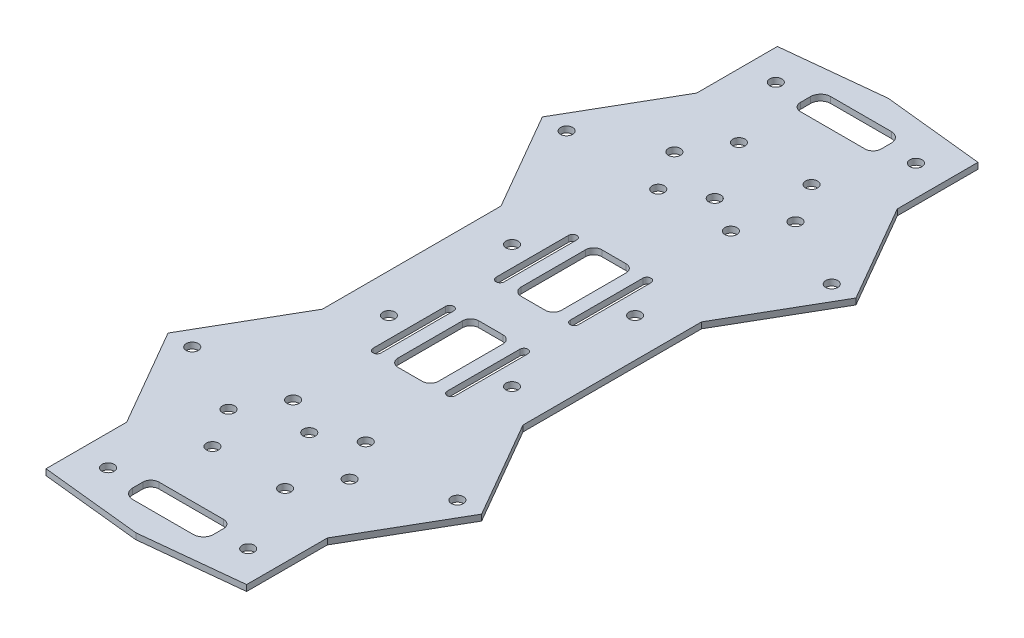
from build123d import *

# Parameters (mm, degrees)
SKETCH1_R           = 1.5
BOSS_EXTRUDE1_DEPTH = 1.5
CUT_EXTRUDE1_DEPTH  = 1.5


with BuildPart() as part:
    # Sketch1 → Boss-Extrude1 (new body)
    with BuildSketch(Plane(origin=(0, 0, 0), x_dir=(1, 0, 0), z_dir=(0, 1, 0))):
        Polygon((0, 93.25), (-24.863047384, 90.636788418), (-24.863047384, 70.636788418), (-38.863047384, 46.388077112), (-24.863047384, 22.139365806), (-24.863047384, -22.139365806), (-38.863047384, -46.388077112), (-24.863047384, -70.636788418), (-24.863047384, -90.636788418), (0, -93.25), (24.863047384, -90.636788418), (24.863047384, -70.636788418), (38.863047384, -46.388077112), (24.863047384, -22.139365806), (24.863047384, 22.139365806), (38.863047384, 46.388077112), (24.863047384, 70.636788418), (24.863047384, 90.636788418), align=None)
        with Locations(Location((0, 50.25, 0), (0, 0, 270))):
            Circle(SKETCH1_R, mode=Mode.SUBTRACT)
        with Locations(Location((-9, 45.25, 0), (0, 0, 270))):
            Circle(SKETCH1_R, mode=Mode.SUBTRACT)
        with Locations(Location((-15, 55.25, 0), (0, 0, 270))):
            Circle(SKETCH1_R, mode=Mode.SUBTRACT)
        with Locations(Location((-9, 65.25, 0), (0, 0, 270))):
            Circle(SKETCH1_R, mode=Mode.SUBTRACT)
        with Locations(Location((9, 45.25, 0), (0, 0, 90))):
            Circle(SKETCH1_R, mode=Mode.SUBTRACT)
        with Locations(Location((9, 65.25, 0), (0, 0, 90))):
            Circle(SKETCH1_R, mode=Mode.SUBTRACT)
        with Locations(Location((15, 55.25, 0), (0, 0, 90))):
            Circle(SKETCH1_R, mode=Mode.SUBTRACT)
        with Locations(Location((-15.25, 15.25, 0), (0, 0, 270))):
            Circle(SKETCH1_R, mode=Mode.SUBTRACT)
        with Locations(Location((15.25, 15.25, 0), (0, 0, 90))):
            Circle(SKETCH1_R, mode=Mode.SUBTRACT)
        with Locations(Location((-32.863047384, 46.388077112, 0), (0, 0, 270))):
            Circle(SKETCH1_R, mode=Mode.SUBTRACT)
        with Locations(Location((-17.363047384, 82.75, 0), (0, 0, 270))):
            Circle(SKETCH1_R, mode=Mode.SUBTRACT)
        with Locations(Location((32.863047384, 46.388077112, 0), (0, 0, 90))):
            Circle(SKETCH1_R, mode=Mode.SUBTRACT)
        with Locations(Location((17.363047384, 82.75, 0), (0, 0, 90))):
            Circle(SKETCH1_R, mode=Mode.SUBTRACT)
        with Locations(Location((-15.25, -15.25, 0), (0, 0, 90))):
            Circle(SKETCH1_R, mode=Mode.SUBTRACT)
        with Locations(Location((15.25, -15.25, 0), (0, 0, 270))):
            Circle(SKETCH1_R, mode=Mode.SUBTRACT)
        with Locations(Location((32.863047384, -46.388077112, 0), (0, 0, 270))):
            Circle(SKETCH1_R, mode=Mode.SUBTRACT)
        with Locations(Location((9, -45.25, 0), (0, 0, 270))):
            Circle(SKETCH1_R, mode=Mode.SUBTRACT)
        with Locations(Location((-32.863047384, -46.388077112, 0), (0, 0, 90))):
            Circle(SKETCH1_R, mode=Mode.SUBTRACT)
        with Locations(Location((-9, -45.25, 0), (0, 0, 90))):
            Circle(SKETCH1_R, mode=Mode.SUBTRACT)
        with Locations(Location((15, -55.25, 0), (0, 0, 270))):
            Circle(SKETCH1_R, mode=Mode.SUBTRACT)
        with Locations(Location((0, -50.25, 0), (0, 0, 90))):
            Circle(SKETCH1_R, mode=Mode.SUBTRACT)
        with Locations(Location((-15, -55.25, 0), (0, 0, 90))):
            Circle(SKETCH1_R, mode=Mode.SUBTRACT)
        with Locations(Location((-9, -65.25, 0), (0, 0, 90))):
            Circle(SKETCH1_R, mode=Mode.SUBTRACT)
        with Locations(Location((9, -65.25, 0), (0, 0, 270))):
            Circle(SKETCH1_R, mode=Mode.SUBTRACT)
        with Locations(Location((17.363047384, -82.75, 0), (0, 0, 270))):
            Circle(SKETCH1_R, mode=Mode.SUBTRACT)
        with Locations(Location((-17.363047384, -82.75, 0), (0, 0, 90))):
            Circle(SKETCH1_R, mode=Mode.SUBTRACT)
        with BuildLine():
            Line((-3, 5.25), (3, 5.25))
            ThreePointArc((3, 5.25), (4.414213562, 5.835786438), (5, 7.25))
            Line((5, 7.25), (5, 23.25))
            ThreePointArc((5, 23.25), (4.414213562, 24.664213562), (3, 25.25))
            Line((3, 25.25), (-3, 25.25))
            ThreePointArc((-3, 25.25), (-4.414213562, 24.664213562), (-5, 23.25))
            Line((-5, 23.25), (-5, 7.25))
            ThreePointArc((-5, 7.25), (-4.414213562, 5.835786438), (-3, 5.25))
        make_face(mode=Mode.SUBTRACT)
        with BuildLine():
            Line((-10.2, 6.25), (-10.2, 24.25))
            ThreePointArc((-10.2, 24.25), (-9.2, 25.25), (-8.2, 24.25))
            Line((-8.2, 24.25), (-8.2, 6.25))
            ThreePointArc((-8.2, 6.25), (-9.2, 5.25), (-10.2, 6.25))
        make_face(mode=Mode.SUBTRACT)
        with BuildLine():
            Line((10.2, 6.25), (10.2, 24.25))
            ThreePointArc((10.2, 24.25), (9.2, 25.25), (8.2, 24.25))
            Line((8.2, 24.25), (8.2, 6.25))
            ThreePointArc((8.2, 6.25), (9.2, 5.25), (10.2, 6.25))
        make_face(mode=Mode.SUBTRACT)
        with BuildLine():
            Line((5, -7.25), (5, -23.25))
            ThreePointArc((5, -23.25), (4.414213562, -24.664213562), (3, -25.25))
            Line((3, -25.25), (-3, -25.25))
            ThreePointArc((-3, -25.25), (-4.414213562, -24.664213562), (-5, -23.25))
            Line((-5, -23.25), (-5, -7.25))
            ThreePointArc((-5, -7.25), (-4.414213562, -5.835786438), (-3, -5.25))
            Line((-3, -5.25), (3, -5.25))
            ThreePointArc((3, -5.25), (4.414213562, -5.835786438), (5, -7.25))
        make_face(mode=Mode.SUBTRACT)
        with BuildLine():
            Line((10.2, -6.25), (10.2, -24.25))
            ThreePointArc((10.2, -24.25), (9.2, -25.25), (8.2, -24.25))
            Line((8.2, -24.25), (8.2, -6.25))
            ThreePointArc((8.2, -6.25), (9.2, -5.25), (10.2, -6.25))
        make_face(mode=Mode.SUBTRACT)
        with BuildLine():
            Line((-10.2, -6.25), (-10.2, -24.25))
            ThreePointArc((-10.2, -24.25), (-9.2, -25.25), (-8.2, -24.25))
            Line((-8.2, -24.25), (-8.2, -6.25))
            ThreePointArc((-8.2, -6.25), (-9.2, -5.25), (-10.2, -6.25))
        make_face(mode=Mode.SUBTRACT)
    extrude(amount=BOSS_EXTRUDE1_DEPTH)

    # Sketch2 → Cut-Extrude1 (cut)
    with BuildSketch(Plane(origin=(0, 1.5, 0), x_dir=(1, 0, 0), z_dir=(0, 1, 0))):
        with BuildLine():
            Line((-8, 79.5), (8, 79.5))
            ThreePointArc((8, 79.5), (9.414213562, 80.085786438), (10, 81.5))
            Line((10, 81.5), (10, 84))
            ThreePointArc((10, 84), (9.267766953, 85.767766953), (7.5, 86.5))
            Line((7.5, 86.5), (-7.5, 86.5))
            ThreePointArc((-7.5, 86.5), (-9.267766953, 85.767766953), (-10, 84))
            Line((-10, 84), (-10, 81.5))
            ThreePointArc((-10, 81.5), (-9.414213562, 80.085786438), (-8, 79.5))
        make_face()
        with BuildLine():
            Line((10, -81.5), (10, -84))
            ThreePointArc((10, -84), (9.267766953, -85.767766953), (7.5, -86.5))
            Line((7.5, -86.5), (-7.5, -86.5))
            ThreePointArc((-7.5, -86.5), (-9.267766953, -85.767766953), (-10, -84))
            Line((-10, -84), (-10, -81.5))
            ThreePointArc((-10, -81.5), (-9.414213562, -80.085786438), (-8, -79.5))
            Line((-8, -79.5), (8, -79.5))
            ThreePointArc((8, -79.5), (9.414213562, -80.085786438), (10, -81.5))
        make_face()
    extrude(amount=-CUT_EXTRUDE1_DEPTH, mode=Mode.SUBTRACT)


solid = part.part
